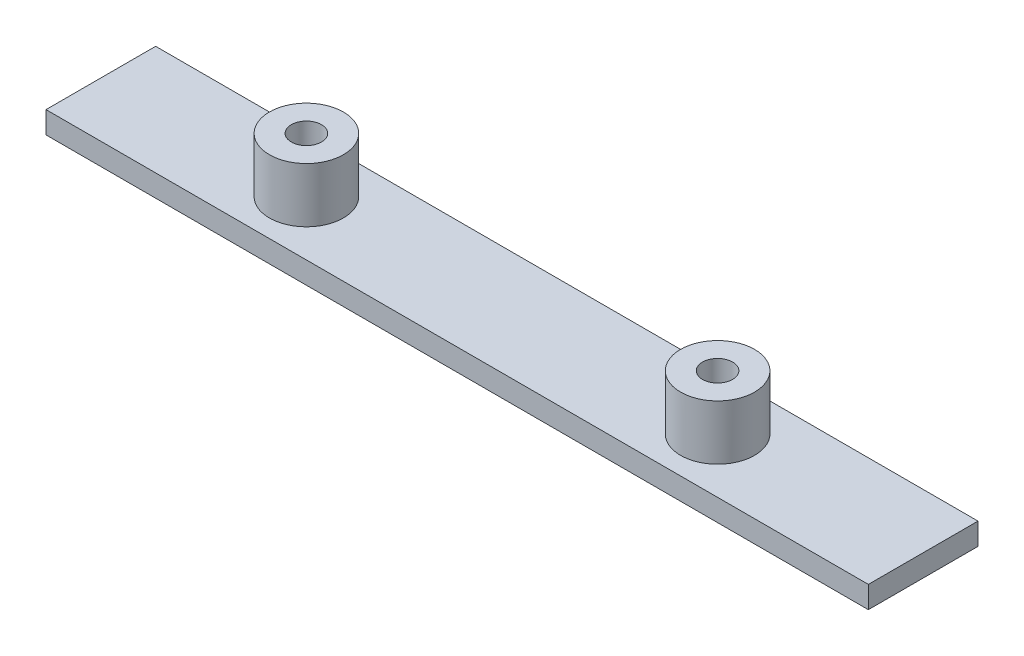
from build123d import *

# Parameters (mm, degrees)
SKETCH1_W           = 75
SKETCH1_H           = 2
BOSS_EXTRUDE1_DEPTH = 10
SKETCH2_R           = 3.375
SKETCH2_R_2         = 1.375
BOSS_EXTRUDE2_DEPTH = 5
SKETCH3_R           = 1.375
CUT_EXTRUDE1_DEPTH  = 40.131189606


with BuildPart() as part:
    # Sketch1 → Boss-Extrude1 (new body)
    with BuildSketch(Plane.XY):
        with Locations((0, 1)):
            Rectangle(SKETCH1_W, SKETCH1_H)
    extrude(amount=BOSS_EXTRUDE1_DEPTH)

    # Sketch2 → Boss-Extrude2 (add)
    # profile 1 of 2: a face of its own
    with BuildSketch(Plane(origin=(0, 2, 0), x_dir=(1, 0, 0), z_dir=(0, 1, 0))):
        with Locations(Location((18.75, -5, 0), (0, 0, 90))):
            Circle(SKETCH2_R)
        with Locations(Location((18.75, -5, 0), (0, 0, 270))):
            Circle(SKETCH2_R_2, mode=Mode.SUBTRACT)
    # profile 2 of 2: a face of its own
    with BuildSketch(Plane(origin=(0, 2, 0), x_dir=(1, 0, 0), z_dir=(0, 1, 0))):
        with Locations(Location((-18.75, -5, 0), (0, 0, 90))):
            Circle(SKETCH2_R)
        with Locations(Location((-18.75, -5, 0), (0, 0, 90))):
            Circle(SKETCH2_R_2, mode=Mode.SUBTRACT)
    extrude(amount=BOSS_EXTRUDE2_DEPTH)

    # Sketch3 → Cut-Extrude1 (cut, through all)
    with BuildSketch(Plane(origin=(0, 2, 0), x_dir=(1, 0, 0), z_dir=(0, 1, 0))):
        with Locations(Location((18.75, -5, 0), (0, 0, 270))):
            Circle(SKETCH3_R)
        with Locations(Location((-18.75, -5, 0), (0, 0, 90))):
            Circle(SKETCH3_R)
    extrude(amount=-CUT_EXTRUDE1_DEPTH, mode=Mode.SUBTRACT)


solid = part.part
